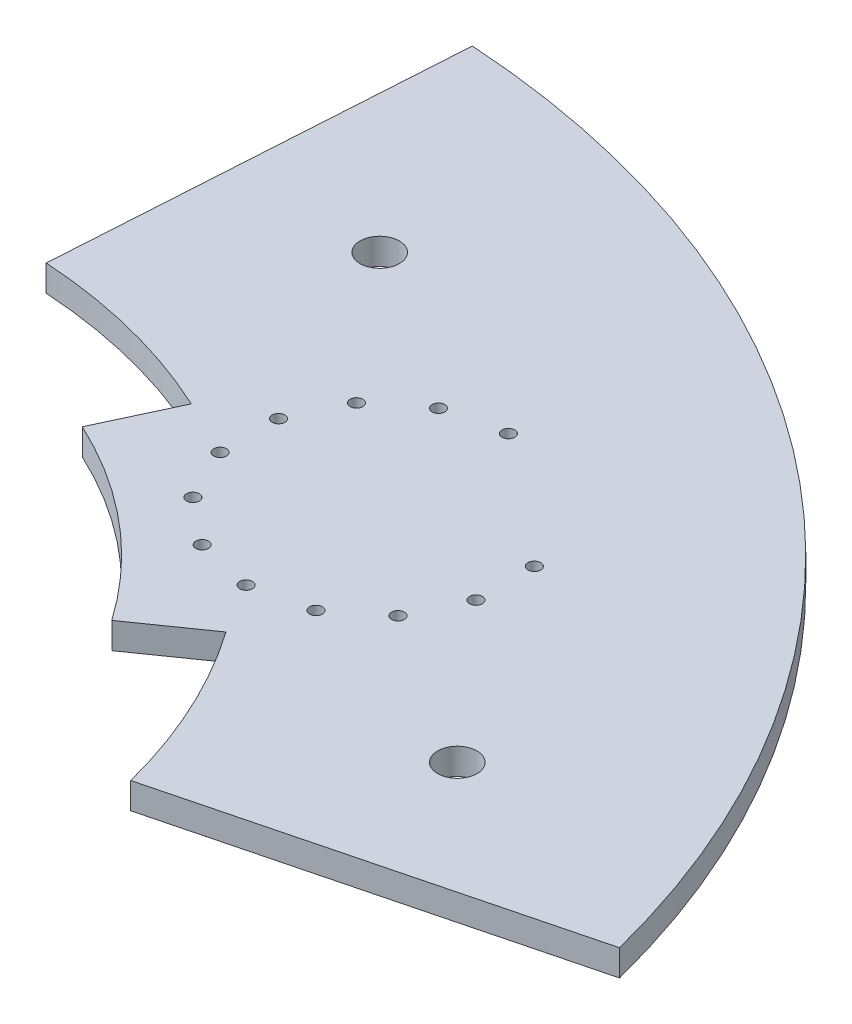
from build123d import *

# Parameters (mm, degrees)
SKETCH2_R           = 5
BOSS_EXTRUDE1_DEPTH = 1.6
SKETCH3_R           = 1.2
CUT_EXTRUDE1_DEPTH  = 1.7
SKETCH10_R          = 0.39
CUT_EXTRUDE6_DEPTH  = 10
BOSS_EXTRUDE3_START = -1.7
SKETCH11_R          = 5
BOSS_EXTRUDE3_DEPTH = 1.7


with BuildPart() as part:
    # Sketch2 → Boss-Extrude1 (new body)
    with BuildSketch(Plane(origin=(0, 0, 0), x_dir=(1, 0, 0), z_dir=(0, 1, 0))):
        with BuildLine():
            Line((-12.84928634, 13.429675326), (-14.381752422, -11.022350105))
            ThreePointArc((-14.381752422, -11.022350105), (-8.311058851, -11.976103518), (-2.52245469, -14.038875409))
            Line((-2.52245469, -14.038875409), (-4.632066163, -18.572035393))
            ThreePointArc((-4.632066163, -18.572035393), (1.543927211, -22.501579223), (6.490366829, -27.897591081))
            Line((6.490366829, -27.897591081), (10.586127051, -25.029708899))
            ThreePointArc((10.586127051, -25.029708899), (13.540412509, -30.180153963), (15.523932384, -35.776629267))
            Line((15.523932384, -35.776629267), (39.259103853, -29.702780788))
            ThreePointArc((39.259103853, -29.702780788), (20.218425809, 0.336488596), (-12.84928634, 13.429675326))
        make_face()
        with Locations(Location((8.721864443, -13.940574544, 0), (0, 0, 270))):
            Circle(SKETCH2_R, mode=Mode.SUBTRACT)
    extrude(amount=BOSS_EXTRUDE1_DEPTH)

    # Sketch3 → Cut-Extrude1 (cut)
    with BuildSketch(Plane(origin=(0, 1.6, 0), x_dir=(1, 0, 0), z_dir=(0, 1, 0))):
        with Locations(Location((-4.780794064, -0.288914882, 0), (0, 0, 270))):
            Circle(SKETCH3_R)
        with Locations(Location((24.519221563, -24.855385868, 0), (0, 0, 270))):
            Circle(SKETCH3_R)
    extrude(amount=-CUT_EXTRUDE1_DEPTH, mode=Mode.SUBTRACT)

    # Sketch10 → Cut-Extrude6 (cut)
    with BuildSketch(Plane(origin=(0, 1.6, 0), x_dir=(1, 0, 0), z_dir=(0, 1, 0))):
        with Locations(Location((5.25079453, -6.732823601, 0), (0, 0, 270))):
            Circle(SKETCH10_R)
        with Locations(Location((8.721864443, -5.940574544, 0), (0, 0, 270))):
            Circle(SKETCH10_R)
        with Locations(Location((2.467212583, -8.952656129, 0), (0, 0, 270))):
            Circle(SKETCH10_R)
        with Locations(Location((0.922441145, -12.160407072, 0), (0, 0, 270))):
            Circle(SKETCH10_R)
        with Locations(Location((0.922441145, -15.720742016, 0), (0, 0, 270))):
            Circle(SKETCH10_R)
        with Locations(Location((2.467212583, -18.928492959, 0), (0, 0, 270))):
            Circle(SKETCH10_R)
        with Locations(Location((5.25079453, -21.148325487, 0), (0, 0, 270))):
            Circle(SKETCH10_R)
        with Locations(Location((8.721864443, -21.940574544, 0), (0, 0, 270))):
            Circle(SKETCH10_R)
        with Locations(Location((12.192934355, -21.148325487, 0), (0, 0, 270))):
            Circle(SKETCH10_R)
        with Locations(Location((14.976516302, -18.928492959, 0), (0, 0, 270))):
            Circle(SKETCH10_R)
        with Locations(Location((16.52128774, -15.720742016, 0), (0, 0, 270))):
            Circle(SKETCH10_R)
        with Locations(Location((16.52128774, -12.160407072, 0), (0, 0, 270))):
            Circle(SKETCH10_R)
    extrude(amount=-CUT_EXTRUDE6_DEPTH, mode=Mode.SUBTRACT)

    # Sketch11 → Boss-Extrude3 (add)
    with BuildSketch(Plane(origin=(0, 1.6, 0), x_dir=(1, 0, 0), z_dir=(0, 1, 0)).offset(BOSS_EXTRUDE3_START)):
        with Locations(Location((8.721864443, -13.940574544, 0), (0, 0, 270))):
            Circle(SKETCH11_R)
    extrude(amount=BOSS_EXTRUDE3_DEPTH)


solid = part.part
